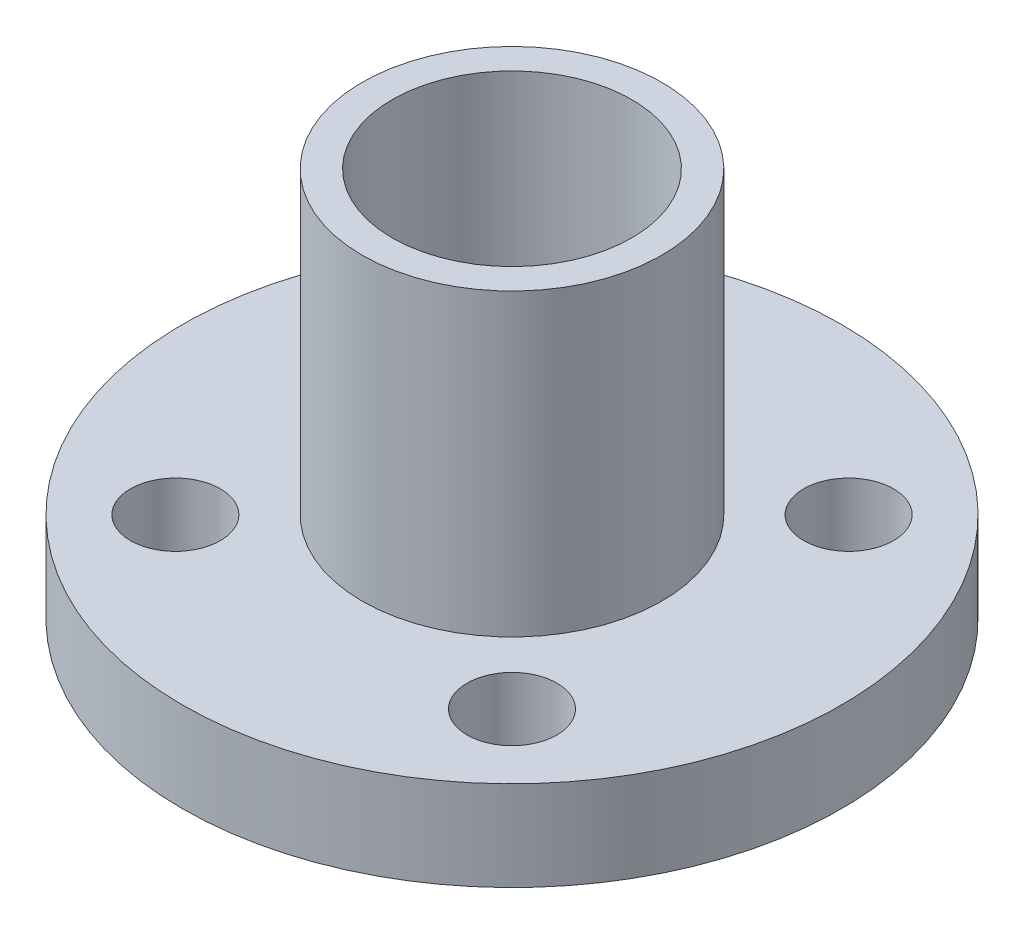
from build123d import *

# Parameters (mm, degrees)
SKETCH1_R           = 11
BOSS_EXTRUDE1_DEPTH = 3
SKETCH2_R           = 1.5
CUT_EXTRUDE1_DEPTH  = 5
SKETCH3_R           = 5
BOSS_EXTRUDE2_DEPTH = 10
SKETCH4_R           = 4
CUT_EXTRUDE2_DEPTH  = 21.273134933


with BuildPart() as part:
    # Sketch1 → Boss-Extrude1 (new body)
    with BuildSketch(Plane(origin=(0, 0, 0), x_dir=(1, 0, 0), z_dir=(0, 1, 0))):
        with Locations(Location((0, 0, 0), (0, 0, 270))):
            Circle(SKETCH1_R)
    extrude(amount=BOSS_EXTRUDE1_DEPTH)

    # Sketch2 → Cut-Extrude1 (cut)
    with BuildSketch(Plane(origin=(0, 3, 0), x_dir=(1, 0, 0), z_dir=(0, 1, 0))):
        with Locations(Location((-5.617707867, 5.617707867, 0), (0, 0, 270))):
            Circle(SKETCH2_R)
        with Locations(Location((5.617707867, 5.617707867, 0), (0, 0, 270))):
            Circle(SKETCH2_R)
        with Locations(Location((-5.617707867, -5.617707867, 0), (0, 0, 270))):
            Circle(SKETCH2_R)
        with Locations(Location((5.617707867, -5.617707867, 0), (0, 0, 270))):
            Circle(SKETCH2_R)
    extrude(amount=-CUT_EXTRUDE1_DEPTH, mode=Mode.SUBTRACT)

    # Sketch3 → Boss-Extrude2 (add)
    with BuildSketch(Plane(origin=(0, 3, 0), x_dir=(1, 0, 0), z_dir=(0, 1, 0))):
        with Locations(Location((0, 0, 0), (0, 0, 270))):
            Circle(SKETCH3_R)
    extrude(amount=BOSS_EXTRUDE2_DEPTH)

    # Sketch4 → Cut-Extrude2 (cut, through all)
    with BuildSketch(Plane(origin=(0, 13, 0), x_dir=(1, 0, 0), z_dir=(0, 1, 0))):
        with Locations(Location((0, 0, 0), (0, 0, 270))):
            Circle(SKETCH4_R)
    extrude(amount=-CUT_EXTRUDE2_DEPTH, mode=Mode.SUBTRACT)


solid = part.part
